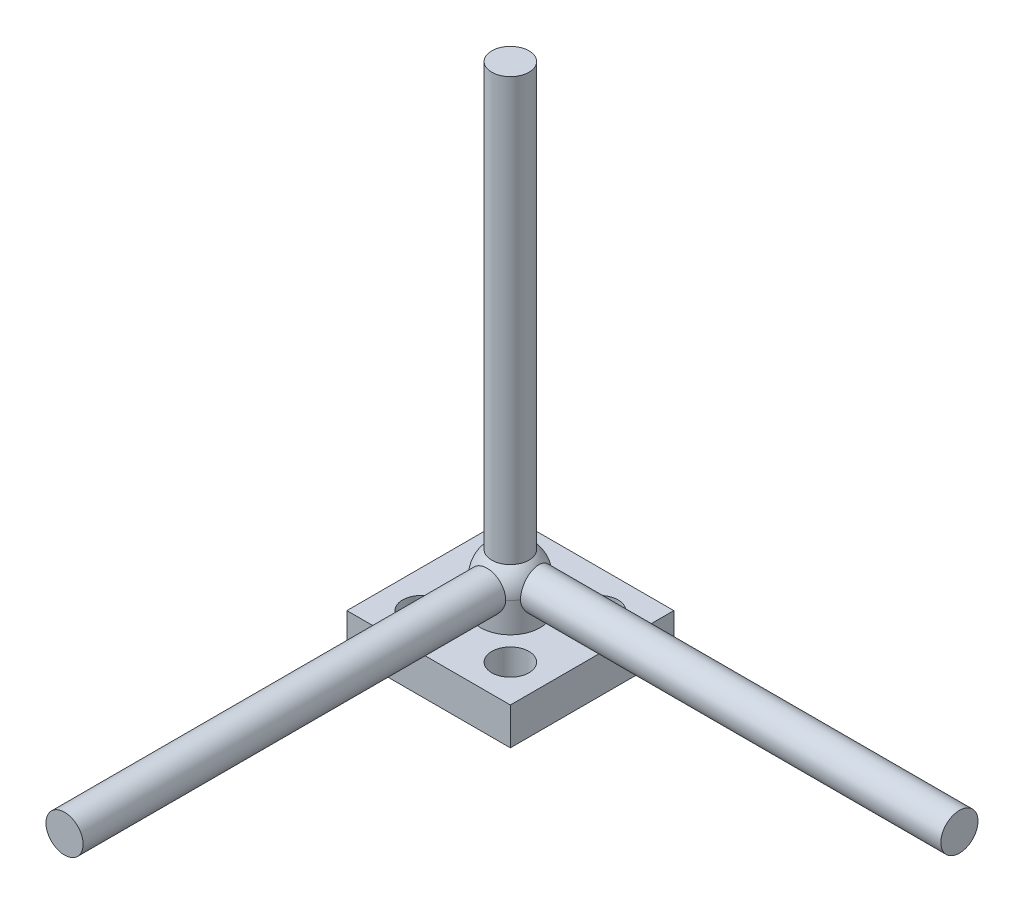
from build123d import *

# Parameters (mm, degrees)
SKETCH_1_W      = 22
SKETCH_1_H      = 22
SKETCH_1_R      = 2.5
EXTRUDE_2_DEPTH = 5
EXTRUDE_START   = 5
SKETCH_3_R      = 4
EXTRUDE_3_DEPTH = 4
SKETCH_5_R      = 2.5
EXTRUDE_4_DEPTH = 64
SKETCH_6_R      = 2.5
EXTRUDE_5_DEPTH = 60
SKETCH_7_R      = 2.5
EXTRUDE_6_DEPTH = 60


with BuildPart() as part:
    # 草图1 → 凸台-拉伸2 (new body)
    with BuildSketch(Plane(origin=(0, 0, 0), x_dir=(1, 0, 0), z_dir=(0, 1, 0))):
        Rectangle(SKETCH_1_W, SKETCH_1_H)
        with Locations(Location((-6, 6, 0), (0, 0, 270))):
            Circle(SKETCH_1_R, mode=Mode.SUBTRACT)
        with Locations(Location((6, 6, 0), (0, 0, 270))):
            Circle(SKETCH_1_R, mode=Mode.SUBTRACT)
        with Locations(Location((-6, -6, 0), (0, 0, 270))):
            Circle(SKETCH_1_R, mode=Mode.SUBTRACT)
        with Locations(Location((6, -6, 0), (0, 0, 270))):
            Circle(SKETCH_1_R, mode=Mode.SUBTRACT)
    extrude(amount=EXTRUDE_2_DEPTH)

    # 草图3 → 凸台-拉伸3 (add)
    with BuildSketch(Plane(origin=(0, 0, 0), x_dir=(1, 0, 0), z_dir=(0, 1, 0)).offset(EXTRUDE_START)):
        with Locations(Location((0, 0, 0), (0, 0, 90))):
            Circle(SKETCH_3_R)
    extrude(amount=EXTRUDE_3_DEPTH)

    # 草图4 → 旋转1 (revolve)
    with BuildSketch(Plane.XY):
        with BuildLine():
            Line((0, 13), (0, 5))
            ThreePointArc((0, 5), (4, 9), (0, 13))
        make_face()
    revolve(axis=Axis((0, -1000, 0), (0, 1, 0)))

    # 草图5 → 凸台-拉伸4 (add)
    with BuildSketch(Plane(origin=(0, 0, 0), x_dir=(1, 0, 0), z_dir=(0, 1, 0)).offset(EXTRUDE_START)):
        with Locations(Location((0, 0, 0), (0, 0, 90))):
            Circle(SKETCH_5_R)
    extrude(amount=EXTRUDE_4_DEPTH)

    # 草图6 → 凸台-拉伸5 (add)
    with BuildSketch(Plane.XY):
        with Locations((0, 9)):
            Circle(SKETCH_6_R)
    extrude(amount=EXTRUDE_5_DEPTH)

    # 草图7 → 凸台-拉伸6 (add)
    with BuildSketch(Plane(origin=(0, 0, 0), x_dir=(0, 0, -1), z_dir=(1, 0, 0))):
        with Locations((0.4387505, 9)):
            Circle(SKETCH_7_R)
    extrude(amount=EXTRUDE_6_DEPTH)


solid = part.part
